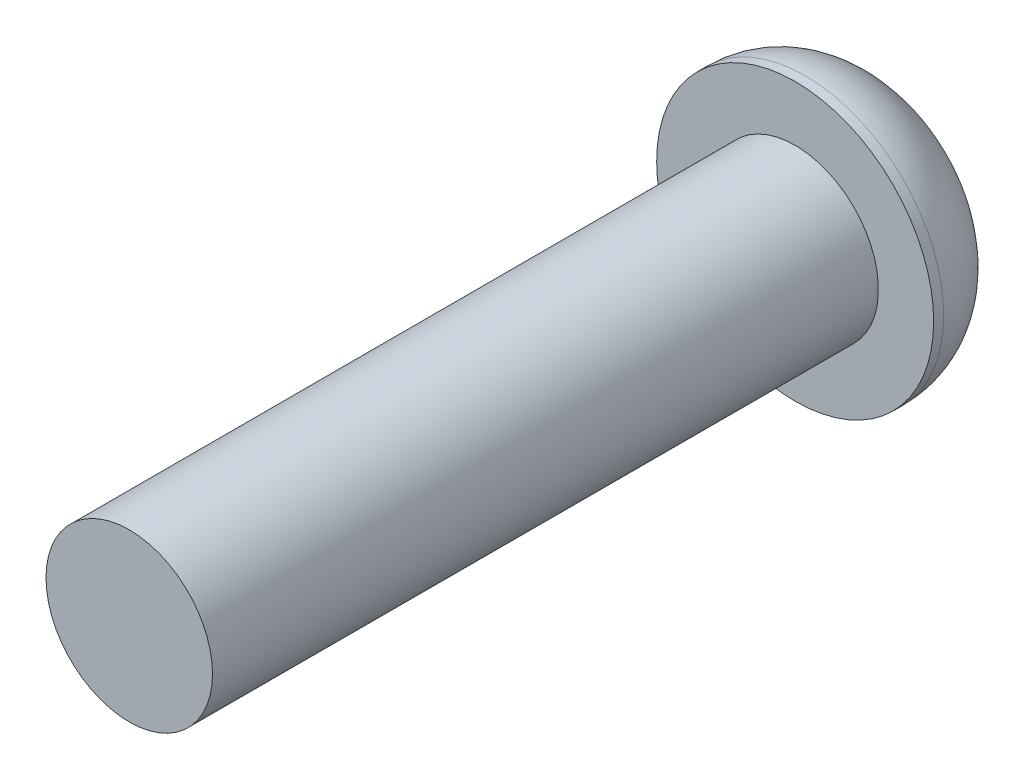
from build123d import *

# Parameters (mm, degrees)
SKETCH1_R           = 2.5
BOSS_EXTRUDE1_DEPTH = 20
SKETCH2_R           = 4.159584877
BOSS_EXTRUDE2_DEPTH = 2.8
FILLET1_R           = 2.5
CUT_EXTRUDE1_DEPTH  = 2


with BuildPart() as part:
    # Sketch1 → Boss-Extrude1 (new body)
    with BuildSketch(Plane.XY):
        Circle(SKETCH1_R)
    extrude(amount=BOSS_EXTRUDE1_DEPTH)

    # Sketch2 → Boss-Extrude2 (add)
    with BuildSketch(Plane(origin=(0, 0, 0), x_dir=(-1, 0, 0), z_dir=(0, 0, -1))):
        Circle(SKETCH2_R)
    extrude(amount=BOSS_EXTRUDE2_DEPTH)

    # Fillet1
    fillet1_edges = [part.edges().sort_by_distance(p)[0] for p in [
        (4.159584877, 0, -2.8),
    ]]
    fillet(fillet1_edges, radius=FILLET1_R)

    # Sketch3 → Cut-Extrude1 (cut)
    with BuildSketch(Plane(origin=(0, 0, -2.8), x_dir=(-1, 0, 0), z_dir=(0, 0, -1))):
        Polygon((1.392434699, -0.636521364), (1.247461021, 0.88762314), (-0.144973678, 1.524144504), (-1.392434699, 0.636521364), (-1.247461021, -0.88762314), (0.144973678, -1.524144504), align=None)
    extrude(amount=-CUT_EXTRUDE1_DEPTH, mode=Mode.SUBTRACT)


solid = part.part
